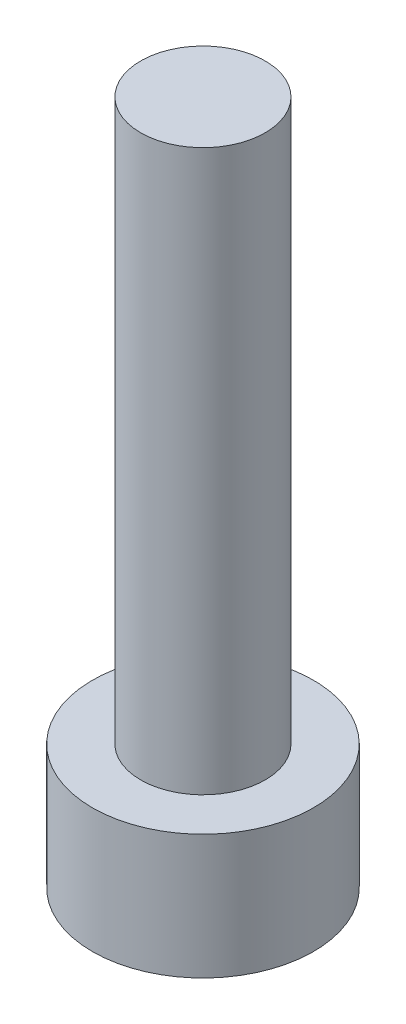
from build123d import *

# Parameters (mm, degrees)
SKETCH_1_R      = 3.55
EXTRUDE_1_DEPTH = 4
SKETCH_2_R      = 2
EXTRUDE_2_DEPTH = 18


with BuildPart() as part:
    # 草图1 → 凸台-拉伸1 (new body)
    with BuildSketch(Plane(origin=(0, 0, 0), x_dir=(1, 0, 0), z_dir=(0, 1, 0))):
        with Locations(Location((0, 0, 0), (0, 0, 270))):
            Circle(SKETCH_1_R)
    extrude(amount=EXTRUDE_1_DEPTH)

    # 草图2 → 凸台-拉伸2 (add)
    with BuildSketch(Plane(origin=(0, 4, 0), x_dir=(1, 0, 0), z_dir=(0, 1, 0))):
        with Locations(Location((0, 0, 0), (0, 0, 270))):
            Circle(SKETCH_2_R)
    extrude(amount=EXTRUDE_2_DEPTH)


solid = part.part
